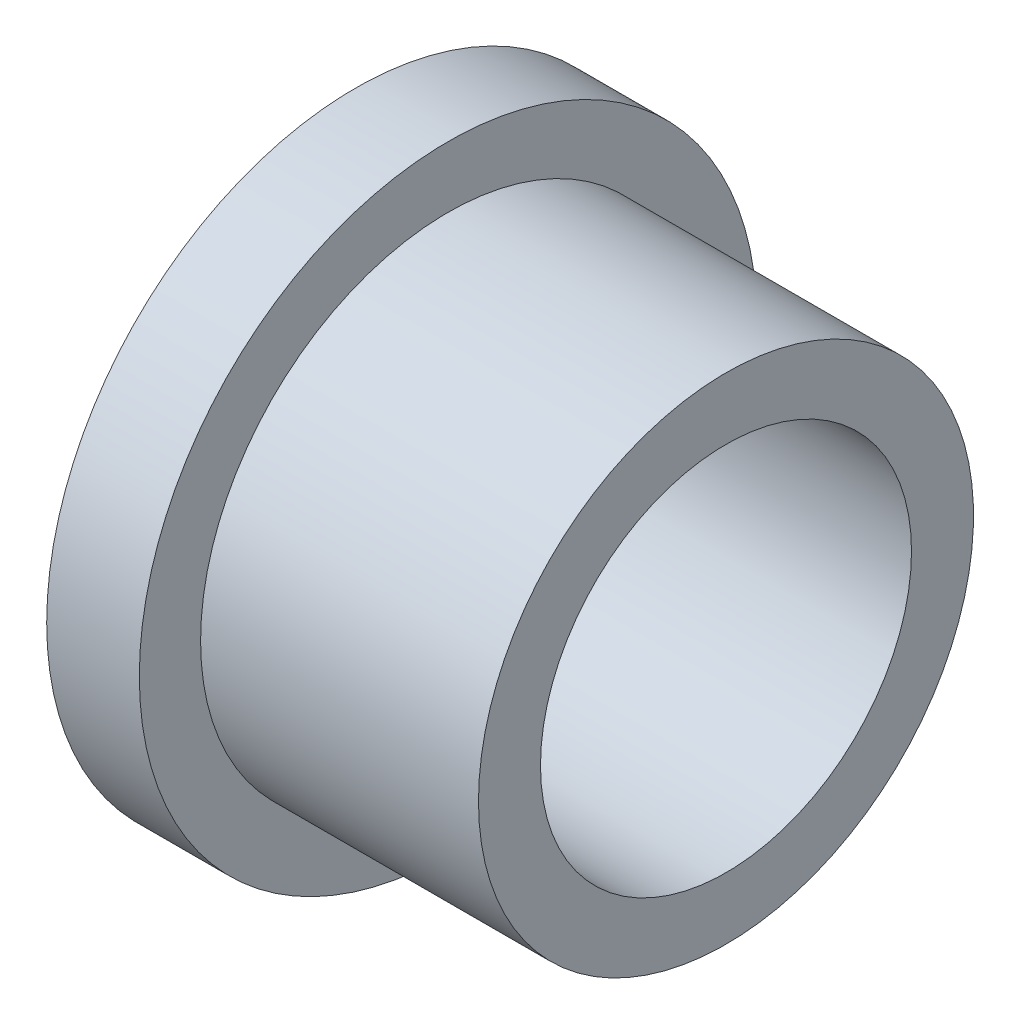
from build123d import *

# Parameters (mm, degrees)
SKETCH1_R           = 15.875
SKETCH1_R_2         = 9.5377
BOSS_EXTRUDE1_DEPTH = 4.7625
SKETCH1_3_R         = 12.7254
SKETCH1_3_R_2       = 9.5377
BOSS_EXTRUDE2_DEPTH = 19.05


with BuildPart() as part:
    # Sketch1 → Boss-Extrude1 (new body)
    with BuildSketch(Plane(origin=(0, 0, 0), x_dir=(0, 0, -1), z_dir=(1, 0, 0))):
        Circle(SKETCH1_R)
        Circle(SKETCH1_R_2, mode=Mode.SUBTRACT)
    extrude(amount=BOSS_EXTRUDE1_DEPTH)

    # Sketch1<3> → Boss-Extrude2 (add)
    with BuildSketch(Plane(origin=(0, 0, 0), x_dir=(0, 0, -1), z_dir=(1, 0, 0))):
        Circle(SKETCH1_3_R)
        Circle(SKETCH1_3_R_2, mode=Mode.SUBTRACT)
    extrude(amount=BOSS_EXTRUDE2_DEPTH)


solid = part.part
